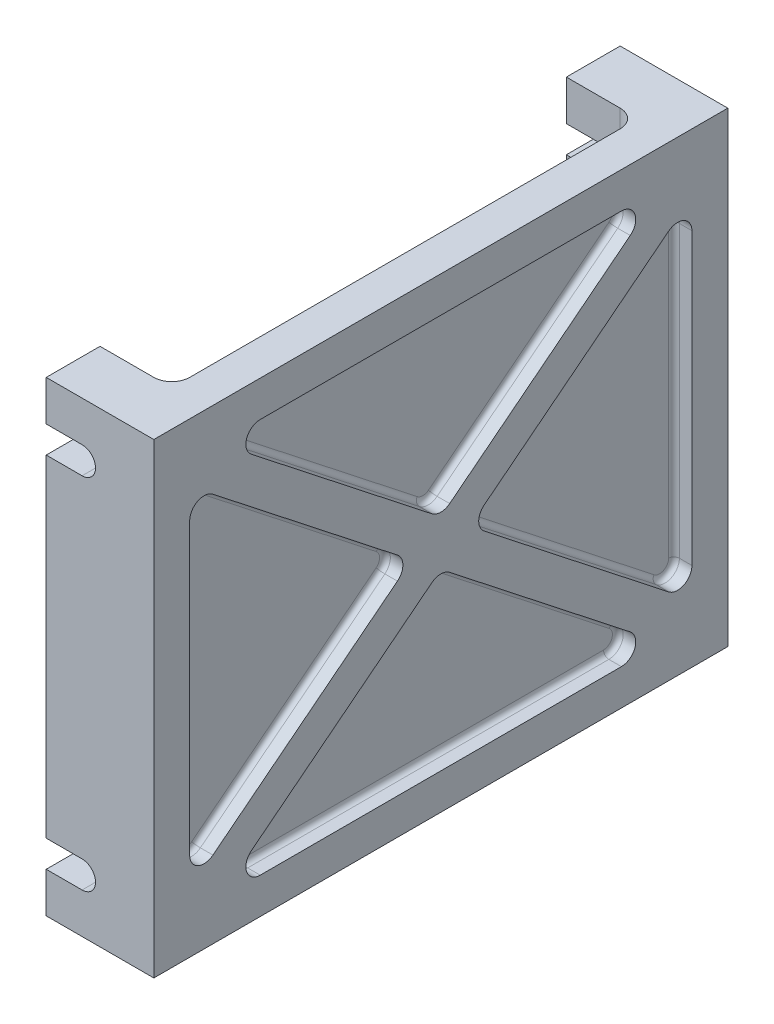
from build123d import *

# Parameters (mm, degrees)
SKETCH1_W           = 101.6
SKETCH1_H           = 82.55
BOSS_EXTRUDE1_DEPTH = 3.175
SKETCH2_W           = 101.6
SKETCH2_H           = 82.55
BOSS_EXTRUDE2_DEPTH = 3.175
FILLET1_R           = 0.9525
SKETCH3_W           = 12.7
SKETCH3_H           = 82.55
BOSS_EXTRUDE3_DEPTH = 9.525
SKETCH4_W           = 12.7
SKETCH4_H           = 82.55
BOSS_EXTRUDE4_DEPTH = 9.525
FILLET2_R           = 3.175
CUT_EXTRUDE2_DEPTH  = 111.396900432


with BuildPart() as part:
    # Sketch1 → Boss-Extrude1 (new body)
    with BuildSketch(Plane(origin=(0, 0, 0), x_dir=(0, 0, -1), z_dir=(1, 0, 0))):
        Rectangle(SKETCH1_W, SKETCH1_H)
    extrude(amount=BOSS_EXTRUDE1_DEPTH)

    # Sketch2 → Boss-Extrude2 (add)
    with BuildSketch(Plane(origin=(3.175, 0, 0), x_dir=(0, 0, -1), z_dir=(1, 0, 0))):
        Rectangle(SKETCH2_W, SKETCH2_H)
        with BuildLine():
            ThreePointArc((-40.340733258, 27.65848557), (-43.020329338, 27.945699456), (-44.45, 25.661236989))
            Line((-44.45, 25.661236989), (-44.45, -25.661236989))
            ThreePointArc((-44.45, -25.661236989), (-43.020329338, -27.945699456), (-40.340733258, -27.65848557))
            Line((-40.340733258, -27.65848557), (-7.68097709, -1.997248581))
            ThreePointArc((-7.68097709, -1.997248581), (-6.710243832, 0), (-7.68097709, 1.997248581))
            Line((-7.68097709, 1.997248581), (-40.340733258, 27.65848557))
        make_face(mode=Mode.SUBTRACT)
        with BuildLine():
            Line((33.536295637, -30.387751419), (1.569266742, -5.270800144))
            ThreePointArc((1.569266742, -5.270800144), (0, -4.728048725), (-1.569266742, -5.270800144))
            Line((-1.569266742, -5.270800144), (-33.536295637, -30.387751419))
            ThreePointArc((-33.536295637, -30.387751419), (-34.367509201, -33.215237498), (-31.967028895, -34.925))
            Line((-31.967028895, -34.925), (31.967028895, -34.925))
            ThreePointArc((31.967028895, -34.925), (34.367509201, -33.215237498), (33.536295637, -30.387751419))
        make_face(mode=Mode.SUBTRACT)
        with BuildLine():
            Line((40.340733258, 27.65848557), (7.68097709, 1.997248581))
            ThreePointArc((7.68097709, 1.997248581), (6.710243832, 0), (7.68097709, -1.997248581))
            Line((7.68097709, -1.997248581), (40.340733258, -27.65848557))
            ThreePointArc((40.340733258, -27.65848557), (43.020329338, -27.945699456), (44.45, -25.661236989))
            Line((44.45, -25.661236989), (44.45, 25.661236989))
            ThreePointArc((44.45, 25.661236989), (43.020329338, 27.945699456), (40.340733258, 27.65848557))
        make_face(mode=Mode.SUBTRACT)
        with BuildLine():
            Line((-33.536295637, 30.387751419), (-1.569266742, 5.270800144))
            ThreePointArc((-1.569266742, 5.270800144), (0, 4.728048725), (1.569266742, 5.270800144))
            Line((1.569266742, 5.270800144), (33.536295637, 30.387751419))
            ThreePointArc((33.536295637, 30.387751419), (34.367509201, 33.215237498), (31.967028895, 34.925))
            Line((31.967028895, 34.925), (-31.967028895, 34.925))
            ThreePointArc((-31.967028895, 34.925), (-34.367509201, 33.215237498), (-33.536295637, 30.387751419))
        make_face(mode=Mode.SUBTRACT)
    extrude(amount=BOSS_EXTRUDE2_DEPTH)

    # Fillet1
    fillet1_edges = [part.edges().sort_by_distance(p)[0] for p in [
        (3.175, 33.215237498, 34.367509201),
        (3.175, 17.829275782, -17.55278119),
        (3.175, 27.945699456, -43.020329338),
        (3.175, -33.215237498, -34.367509201),
        (3.175, -34.925, 0),
        (3.175, 0, 6.710243832),
        (3.175, -14.827867075, 24.010855174),
        (3.175, -27.945699456, 43.020329338),
        (3.175, 0, -6.710243832),
        (3.175, -4.728048725, 0),
        (3.175, 0, 44.45),
        (3.175, 4.728048725, 0),
        (3.175, 27.945699456, 43.020329338),
        (3.175, 14.827867075, 24.010855174),
        (3.175, -17.829275782, -17.55278119),
        (3.175, -17.829275782, 17.55278119),
        (3.175, -33.215237498, 34.367509201),
        (3.175, 14.827867075, -24.010855174),
        (3.175, -14.827867075, -24.010855174),
        (3.175, -27.945699456, -43.020329338),
        (3.175, 0, -44.45),
        (3.175, 17.829275782, 17.55278119),
        (3.175, 33.215237498, -34.367509201),
        (3.175, 34.925, 0),
    ]]
    fillet(fillet1_edges, radius=FILLET1_R)

    # Sketch3 → Boss-Extrude3 (add)
    with BuildSketch(Plane(origin=(0, 0, -50.8), x_dir=(-1, 0, 0), z_dir=(0, 0, -1))):
        with Locations((6.35, 0)):
            Rectangle(SKETCH3_W, SKETCH3_H)
    extrude(amount=-BOSS_EXTRUDE3_DEPTH)

    # Sketch4 → Boss-Extrude4 (add)
    with BuildSketch(Plane.XY.offset(50.8)):
        with Locations((-6.35, 0)):
            Rectangle(SKETCH4_W, SKETCH4_H)
    extrude(amount=-BOSS_EXTRUDE4_DEPTH)

    # Fillet2
    fillet2_edges = [part.edges().sort_by_distance(p)[0] for p in [
        (0, 0, 41.275),
        (0, 0, -41.275),
    ]]
    fillet(fillet2_edges, radius=FILLET2_R)

    # Sketch5 → Cut-Extrude2 (cut, through all)
    with BuildSketch(Plane.XY.offset(50.8)):
        with BuildLine():
            Line((-12.7, 29.36875), (-6.35, 29.36875))
            ThreePointArc((-6.35, 29.36875), (-3.96875, 31.75), (-6.35, 34.13125))
            Line((-6.35, 34.13125), (-12.7, 34.13125))
            Line((-12.7, 34.13125), (-12.7, 29.36875))
        make_face()
        with BuildLine():
            Line((-12.7, -34.13125), (-6.35, -34.13125))
            ThreePointArc((-6.35, -34.13125), (-3.96875, -31.75), (-6.35, -29.36875))
            Line((-6.35, -29.36875), (-12.7, -29.36875))
            Line((-12.7, -29.36875), (-12.7, -34.13125))
        make_face()
    extrude(amount=-CUT_EXTRUDE2_DEPTH, mode=Mode.SUBTRACT)


solid = part.part
